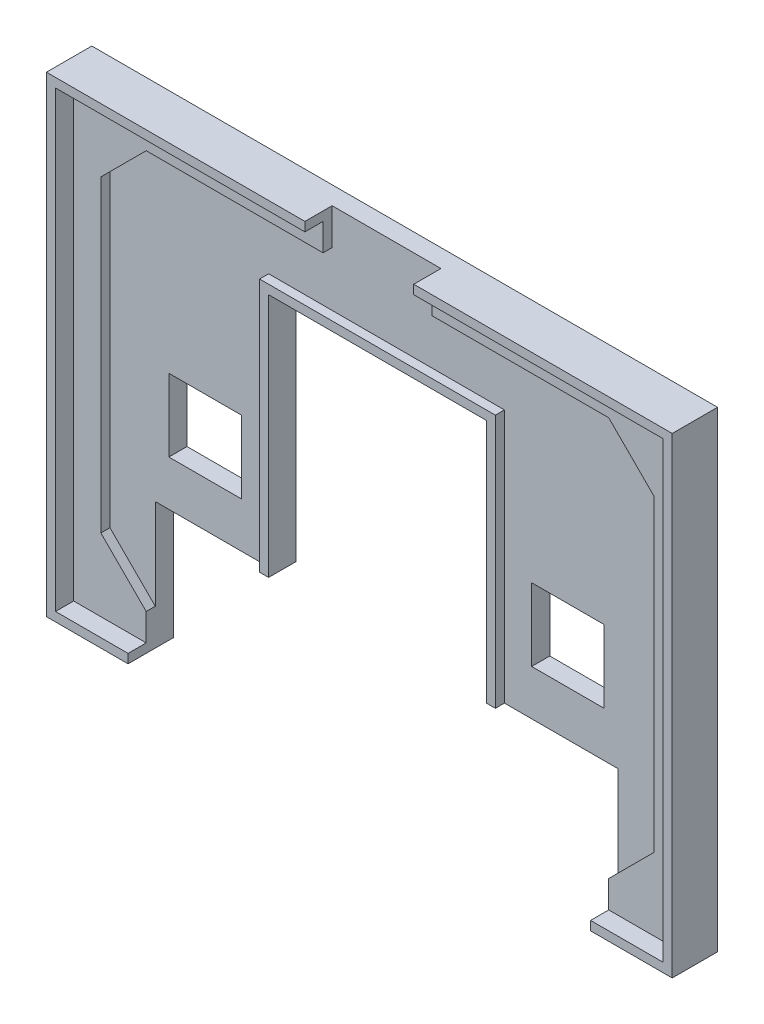
from build123d import *

# Parameters (mm, degrees)
SKICA1_W                    = 67
SKICA1_H                    = 50
P_IDAT_VYSUNUT_M1_DEPTH     = 3
ODEBRAT_VYSUNUT_M1_DEPTH    = 1
SKICA3_W                    = 8
SKICA3_H                    = 8
ODEBRAT_VYSUNUT_M2_DEPTH    = 42.907636536
VYSUNOUT_TENKOST_NN_1_DEPTH = 1
VYSUNOUT_TENKOST_NN_2_DEPTH = 5
SKICA6_W                    = 12
SKICA6_H                    = 4
ODEBRAT_VYSUNUT_M3_DEPTH    = 44.304156844
ODEBRAT_VYSUNUT_M4_DEPTH    = 1
P_IDAT_START                = -1
SKICA8_W                    = 2
SKICA8_H                    = 2
P_IDAT_VYSUNUT_M2_DEPTH     = 1
ODEBRAT_VYSUNUT_M5_DEPTH    = 1
SKICA10_W                   = 1.6
SKICA10_H                   = 2.4
SKICA10_H_2                 = 1.6
P_IDAT_VYSUNUT_M3_DEPTH     = 1


with BuildPart() as part:
    # Skica1 → Přidat vysunutím1 (new body)
    with BuildSketch(Plane.XY):
        Rectangle(SKICA1_W, SKICA1_H)
    extrude(amount=P_IDAT_VYSUNUT_M1_DEPTH)

    # Skica2 → Odebrat vysunutím1 (cut)
    with BuildSketch(Plane.XY.offset(3)):
        Polygon((-25.5, -22), (-30.5, -17), (-30.5, 17), (-25.5, 22), (25.5, 22), (30.5, 17), (30.5, -17), (25.5, -22), align=None)
    extrude(amount=-ODEBRAT_VYSUNUT_M1_DEPTH, mode=Mode.SUBTRACT)

    # Skica3 → Odebrat vysunutím2 (cut, through all)
    with BuildSketch(Plane(origin=(0, 0, 0), x_dir=(-1, 0, 0), z_dir=(0, 0, -1))):
        with Locations((20, -3)):
            Rectangle(SKICA3_W, SKICA3_H)
        with Locations((-20, -3)):
            Rectangle(SKICA3_W, SKICA3_H)
        Polygon((25.5, -25), (-25.5, -25), (-25.5, -12), (-12, -12), (-12, 15), (12, 15), (12, -12), (25.5, -12), align=None)
    extrude(amount=-ODEBRAT_VYSUNUT_M2_DEPTH, mode=Mode.SUBTRACT)

    # Skica4 → Vysunout tenkostěnný1 (add)
    with BuildSketch(Plane.XY.offset(2)):
        Polygon((-12, -12), (-12, 15), (12, 15), (12, -12), (13, -12), (13, 16), (-13, 16), (-13, -12), align=None)
    extrude(amount=VYSUNOUT_TENKOST_NN_1_DEPTH)

    # Skica5 → Vysunout tenkostěnný2 (add)
    with BuildSketch(Plane(origin=(0, 0, 0), x_dir=(-1, 0, 0), z_dir=(0, 0, -1))):
        Polygon((-25.5, -25), (-33.5, -25), (-33.5, 25), (33.5, 25), (33.5, -25), (25.5, -25), (25.5, -26), (34.5, -26), (34.5, 26), (-34.5, 26), (-34.5, -26), (-25.5, -26), align=None)
    extrude(amount=-VYSUNOUT_TENKOST_NN_2_DEPTH)

    # Skica6 → Odebrat vysunutím3 (cut, through all)
    with BuildSketch(Plane.XY.offset(2)):
        with Locations((0, 24)):
            Rectangle(SKICA6_W, SKICA6_H)
    extrude(amount=ODEBRAT_VYSUNUT_M3_DEPTH, mode=Mode.SUBTRACT)

    # Skica7 → Odebrat vysunutím4 (cut)
    with BuildSketch(Plane(origin=(0, 0, 0), x_dir=(-1, 0, 0), z_dir=(0, 0, -1))):
        Polygon((-28.75, 22), (-26.75, 22), (-26.75, 21), (-25.75, 21), (-25.75, 16), (-20.75, 16), (-20.75, 21), (-19.75, 21), (-19.75, 22), (-17.75, 22), (-17.75, 21), (-16.75, 21), (-16.75, 14), (-15.75, 14), (-15.75, 8), (-16.75, 8), (-16.75, 7), (-17.75, 7), (-17.75, 6), (-18.75, 6), (-18.75, 5), (-27.75, 5), (-27.75, 6), (-28.75, 6), (-28.75, 7), (-29.75, 7), (-29.75, 8), (-30.75, 8), (-30.75, 14), (-29.75, 14), (-29.75, 21), (-28.75, 21), align=None)
        Polygon((18.75, 6), (18.75, 5), (27.75, 5), (27.75, 6), (28.75, 6), (28.75, 7), (29.75, 7), (29.75, 8), (30.75, 8), (30.75, 14), (29.75, 14), (29.75, 21), (28.75, 21), (28.75, 22), (26.75, 22), (26.75, 21), (25.75, 21), (25.75, 16), (20.75, 16), (20.75, 21), (19.75, 21), (19.75, 22), (17.75, 22), (17.75, 21), (16.75, 21), (16.75, 14), (15.75, 14), (15.75, 8), (16.75, 8), (16.75, 7), (17.75, 7), (17.75, 6), align=None)
    extrude(amount=-ODEBRAT_VYSUNUT_M4_DEPTH, mode=Mode.SUBTRACT)

    # Skica8 → Přidat vysunutím2 (add)
    with BuildSketch(Plane(origin=(0, 0, 0), x_dir=(-1, 0, 0), z_dir=(0, 0, -1)).offset(P_IDAT_START)):
        with Locations((-26.75, 11)):
            Rectangle(SKICA8_W, SKICA8_H)
        with Locations((-19.75, 11)):
            Rectangle(SKICA8_W, SKICA8_H)
        Polygon((-23.75, 10), (-22.75, 10), (-22.75, 9), (-21.75, 9), (-21.75, 8), (-24.75, 8), (-24.75, 9), (-23.75, 9), align=None)
        Polygon((24.75, 9), (23.75, 9), (23.75, 10), (22.75, 10), (22.75, 9), (21.75, 9), (21.75, 8), (24.75, 8), align=None)
        with Locations((26.75, 11)):
            Rectangle(SKICA8_W, SKICA8_H)
        with Locations((19.75, 11)):
            Rectangle(SKICA8_W, SKICA8_H)
    extrude(amount=P_IDAT_VYSUNUT_M2_DEPTH)

    # Skica9 → Odebrat vysunutím5 (cut)
    with BuildSketch(Plane(origin=(0, 0, 0), x_dir=(-1, 0, 0), z_dir=(0, 0, -1))):
        Polygon((-11.2, 23.3), (-9.6, 23.3), (-9.6, 19.3), (-8.8, 19.3), (-8.8, 21.7), (-8, 21.7), (-8, 19.3), (-7.2, 19.3), (-7.2, 23.3), (-5.6, 23.3), (-5.6, 18.5), (-6.4, 18.5), (-6.4, 17.7), (-8, 17.7), (-8, 18.5), (-8.8, 18.5), (-8.8, 17.7), (-10.4, 17.7), (-10.4, 18.5), (-11.2, 18.5), align=None)
        Polygon((-4.8, 23.3), (-3.2, 23.3), (-3.2, 20.9), (-1.6, 20.9), (-1.6, 23.3), (0, 23.3), (0, 17.7), (-1.6, 17.7), (-1.6, 20.1), (-3.2, 20.1), (-3.2, 17.7), (-4.8, 17.7), align=None)
        Polygon((1.6, 23.3), (4.8, 23.3), (4.8, 22.5), (5.6, 22.5), (5.6, 18.5), (4.8, 18.5), (4.8, 17.7), (1.6, 17.7), (1.6, 18.5), (0.8, 18.5), (0.8, 22.5), (1.6, 22.5), align=None)
        Polygon((6.4, 23.3), (10.4, 23.3), (10.4, 22.5), (11.2, 22.5), (11.2, 20.9), (10.4, 20.9), (10.4, 20.1), (8, 20.1), (8, 17.7), (6.4, 17.7), align=None)
    extrude(amount=-ODEBRAT_VYSUNUT_M5_DEPTH, mode=Mode.SUBTRACT)

    # Skica10 → Přidat vysunutím3 (add)
    with BuildSketch(Plane(origin=(0, 0, 0), x_dir=(-1, 0, 0), z_dir=(0, 0, -1)).offset(P_IDAT_START)):
        with Locations((3.2, 20.5)):
            Rectangle(SKICA10_W, SKICA10_H)
        with Locations((8.8, 21.7)):
            Rectangle(SKICA10_W, SKICA10_H_2)
    extrude(amount=P_IDAT_VYSUNUT_M3_DEPTH)


solid = part.part
